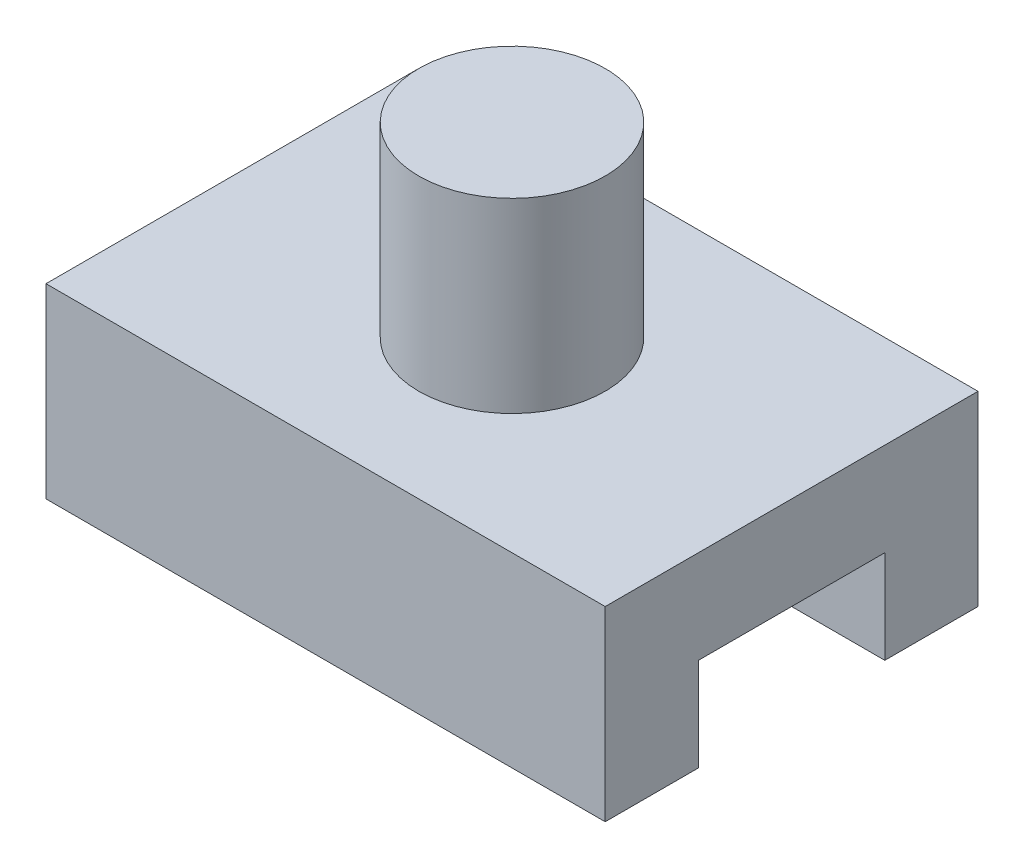
from build123d import *

# Parameters (mm, degrees)
SKETCH1_W           = 60
SKETCH1_H           = 40
BOSS_EXTRUDE1_DEPTH = 20
SKETCH2_R           = 10
BOSS_EXTRUDE2_DEPTH = 20
SKETCH4_W           = 20
SKETCH4_H           = 10
CUT_EXTRUDE1_DEPTH  = 75.833147735


with BuildPart() as part:
    # Sketch1 → Boss-Extrude1 (new body)
    with BuildSketch(Plane(origin=(0, 0, 0), x_dir=(1, 0, 0), z_dir=(0, 1, 0))):
        Rectangle(SKETCH1_W, SKETCH1_H)
    extrude(amount=BOSS_EXTRUDE1_DEPTH)

    # Sketch2 → Boss-Extrude2 (add)
    with BuildSketch(Plane(origin=(0, 20, 0), x_dir=(1, 0, 0), z_dir=(0, 1, 0))):
        with Locations(Location((0, 0, 0), (0, 0, 270))):
            Circle(SKETCH2_R)
    extrude(amount=BOSS_EXTRUDE2_DEPTH)

    # Sketch4 → Cut-Extrude1 (cut, through all)
    with BuildSketch(Plane.ZY.offset(30)):
        with Locations((0, 5)):
            Rectangle(SKETCH4_W, SKETCH4_H)
    extrude(amount=-CUT_EXTRUDE1_DEPTH, mode=Mode.SUBTRACT)


solid = part.part
